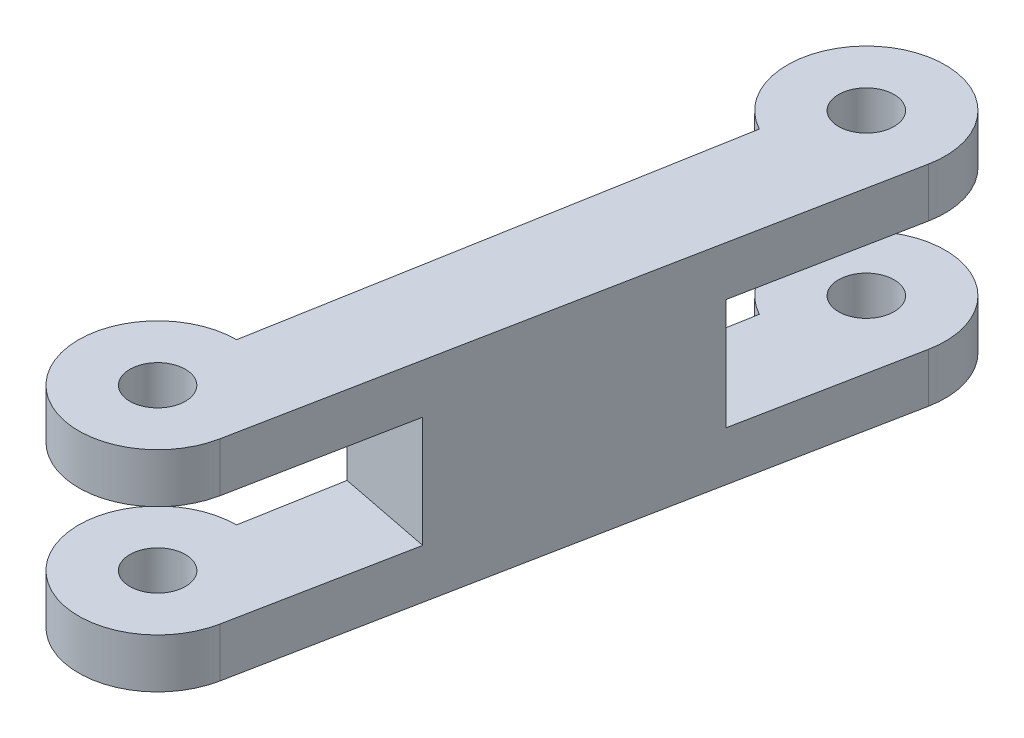
from build123d import *

# Parameters (mm, degrees)
SKETCH1_R           = 1.125
BOSS_EXTRUDE6_DEPTH = 8.5
SKETCH4_W           = 17.570802181
SKETCH4_H           = 4.5
SKETCH4_W_2         = 16.739440307
CUT_EXTRUDE2_DEPTH  = 8.5


with BuildPart() as part:
    # Sketch1 → Boss-Extrude6 (new body)
    with BuildSketch(Plane(origin=(0, 0, 0), x_dir=(1, 0, 0), z_dir=(0, 1, 0))):
        with BuildLine():
            Line((-53.339502585, 64.261265029), (-58.054988047, 40.260584684))
            ThreePointArc((-58.054988047, 40.260584684), (-63.66620673, 38.844543261), (-61.19495789, 44.077503952))
            Line((-61.19495789, 44.077503952), (-57.99495789, 62.059797556))
            ThreePointArc((-57.99495789, 62.059797556), (-57.847446161, 67.771045832), (-53.339502585, 64.261265029))
        make_face()
        with Locations(Location((-56.479472428, 64.878184296, 0), (0, 0, 270))):
            Circle(SKETCH1_R, mode=Mode.SUBTRACT)
        with Locations(Location((-61.19495789, 40.877503952, 0), (0, 0, 270))):
            Circle(SKETCH1_R, mode=Mode.SUBTRACT)
    extrude(amount=BOSS_EXTRUDE6_DEPTH)

    # Sketch4 → Cut-Extrude2 (cut)
    with BuildSketch(Plane(origin=(-63.513384964, 0, -12.478664734), x_dir=(0.1927872711997429, 0, -0.9812405760379851), z_dir=(0.9812405760379851, 0, 0.1927872711997429))):
        with Locations((54.557984654, 4.25)):
            Rectangle(SKETCH4_W, SKETCH4_H)
        with Locations((26.943336429, 4.25)):
            Rectangle(SKETCH4_W_2, SKETCH4_H)
    extrude(amount=-CUT_EXTRUDE2_DEPTH, mode=Mode.SUBTRACT)


solid = part.part
